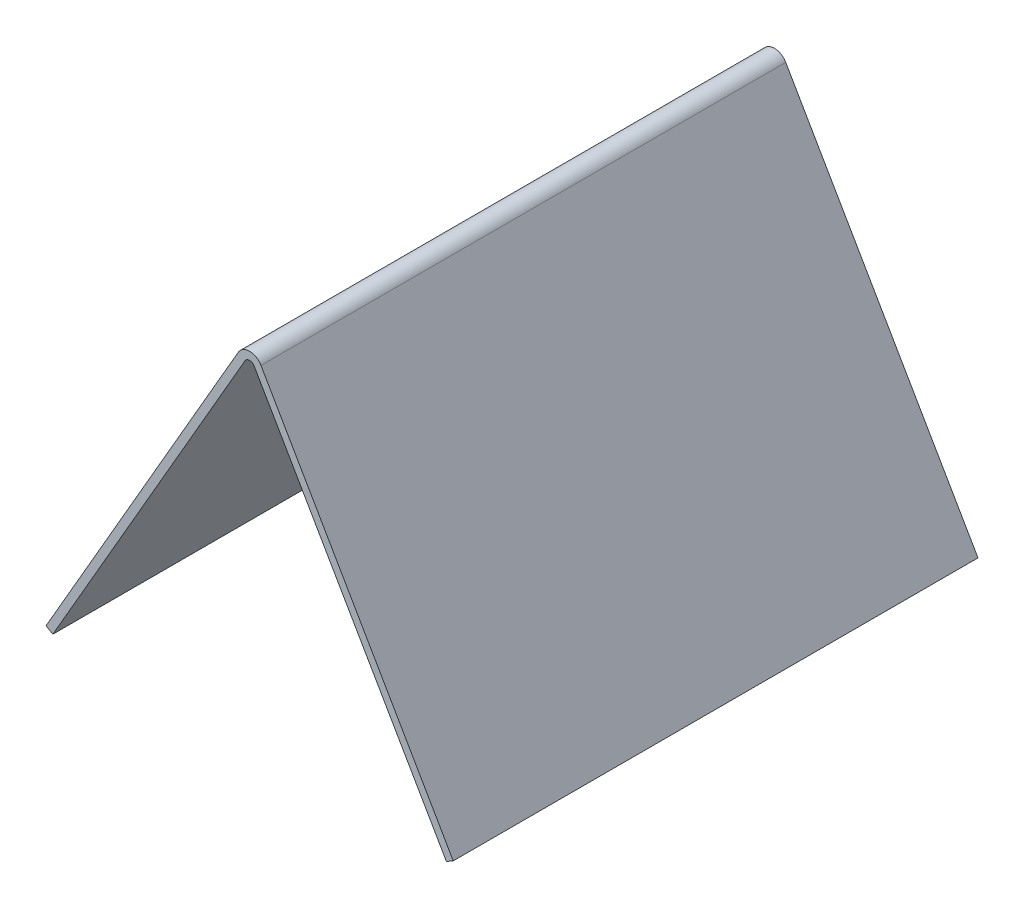
from build123d import *

# Parameters (mm, degrees)
BOSS_EXTRUDE1_DEPTH = 200


with BuildPart() as part:
    # Sketch1 → Boss-Extrude1 (new body)
    with BuildSketch(Plane.XY):
        with BuildLine():
            Line((-1.732050808, 126.903810568), (-75, 0))
            Line((-75, 0), (-77.598076211, 1.5))
            Line((-77.598076211, 1.5), (-4.330127019, 128.403810568))
            ThreePointArc((-4.330127019, 128.403810568), (0, 130.903810568), (4.330127019, 128.403810568))
            Line((4.330127019, 128.403810568), (77.598076211, 1.5))
            Line((77.598076211, 1.5), (75, 0))
            Line((75, 0), (1.732050808, 126.903810568))
            ThreePointArc((1.732050808, 126.903810568), (0, 127.903810568), (-1.732050808, 126.903810568))
        make_face()
    extrude(amount=BOSS_EXTRUDE1_DEPTH)


solid = part.part
